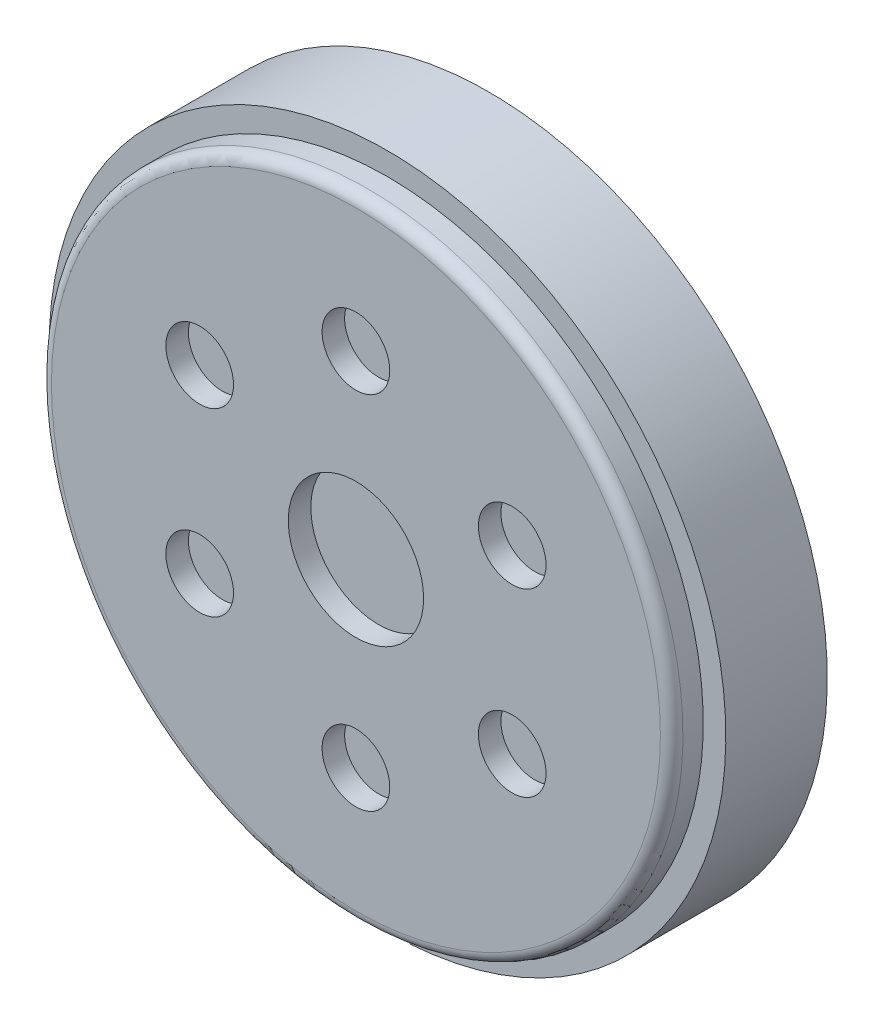
from build123d import *

# Parameters (mm, degrees)
FILLET_1_R          = 0.25
SKETCH_2_R          = 1.5
SKETCH_2_R_2        = 0.75
CUT_EXTRUDE_1_DEPTH = 0.5
CUT_EXTRUDE_2_REACH = 13.036
CUT_EXTRUDE_3_DEPTH = 0.5
CUT_EXTRUDE_4_DEPTH = 0.8
EXTRUDE_1_DEPTH     = 0.2


with BuildPart() as part:
    # Эскиз1 → Повернуть1 (revolve)
    with BuildSketch(Plane(origin=(0, 0, 0), x_dir=(1, 0, 0), z_dir=(0, 1, 0)), mode=Mode.PRIVATE) as revolve_1_sk:
        Polygon((0, 0), (0, -3.75), (-7, -3.75), (-7, -3.05), (-7.5, -3.05), (-7.5, -0.8), (-5.55, -0.8), (-5.55, 0), align=None)
    revolve(revolve_1_sk.sketch.rotate(Axis((0, 0, 0), (0, 0, -1)), 180), axis=Axis((0, 0, 0), (0, 0, -1)))

    # Скругление1
    fillet_1_edges = [part.edges().sort_by_distance(p)[0] for p in [
        (-5.55, 0, 0),
        (-7, 0, 3.75),
    ]]
    fillet(fillet_1_edges, radius=FILLET_1_R)

    # Эскиз2 → Вырез-Вытянуть1 (cut)
    with BuildSketch(Plane.XY.offset(3.75)):
        Circle(SKETCH_2_R)
        with Locations((0, -4)):
            Circle(SKETCH_2_R_2)
        with Locations((-3.464101615, -2)):
            Circle(SKETCH_2_R_2)
        with Locations((-3.464101615, 2)):
            Circle(SKETCH_2_R_2)
        with Locations((0, 4)):
            Circle(SKETCH_2_R_2)
        with Locations((3.464101615, 2)):
            Circle(SKETCH_2_R_2)
        with Locations((3.464101615, -2)):
            Circle(SKETCH_2_R_2)
    extrude(amount=-CUT_EXTRUDE_1_DEPTH, mode=Mode.SUBTRACT)

    # Эскиз3 → Вырез-Вытянуть2 (cut, up to next)
    with BuildSketch(Plane.XY.offset(3.05), mode=Mode.PRIVATE) as cut_extrude_2_sk1:
        with BuildLine():
            Line((0.5, -6.982120022), (0.5, -7.483314774))
            ThreePointArc((0.5, -7.483314774), (0, -7.5), (-0.5, -7.483314774))
            Line((-0.5, -7.483314774), (-0.5, -6.982120022))
            ThreePointArc((-0.5, -6.982120022), (0, -7), (0.5, -6.982120022))
        make_face()
    cut_extrude_2_tool1 = extrude(cut_extrude_2_sk1.sketch, amount=-CUT_EXTRUDE_2_REACH, mode=Mode.PRIVATE) & part.part
    add(cut_extrude_2_tool1.solids().sort_by_distance((0, -7.244238, 3.05))[0], mode=Mode.SUBTRACT)

    # Эскиз4 → Вырез-Вытянуть3 (cut)
    with BuildSketch(Plane(origin=(0, 0, 0.8), x_dir=(-1, 0, 0), z_dir=(0, 0, -1))):
        with BuildLine():
            Line((-4.751554754, -4.435394844), (-4.166748015, -3.889500094))
            ThreePointArc((-4.166748015, -3.889500094), (-5.421022143, -1.761396868), (-5.657160749, 0.697518642))
            Line((-5.657160749, 0.697518642), (-6.451148223, 0.795415996))
            ThreePointArc((-6.451148223, 0.795415996), (-6.181867356, -2.008610463), (-4.751554754, -4.435394844))
        make_face()
        with BuildLine():
            Line((-5.686622337, 3.148384728), (-4.986730357, 2.760891223))
            ThreePointArc((-4.986730357, 2.760891223), (-3.350375938, 4.611396868), (-1.084779161, 5.595824709))
            Line((-1.084779161, 5.595824709), (-1.237028868, 6.381203615))
            ThreePointArc((-1.237028868, 6.381203615), (-3.82060414, 5.258610463), (-5.686622337, 3.148384728))
        make_face()
        with BuildLine():
            Line((1.237028868, 6.381203615), (1.084779161, 5.595824709))
            ThreePointArc((1.084779161, 5.595824709), (3.350375938, 4.611396868), (4.986730357, 2.760891223))
            Line((4.986730357, 2.760891223), (5.686622337, 3.148384728))
            ThreePointArc((5.686622337, 3.148384728), (3.82060414, 5.258610463), (1.237028868, 6.381203615))
        make_face()
        with BuildLine():
            Line((6.451148223, 0.795415996), (5.657160749, 0.697518642))
            ThreePointArc((5.657160749, 0.697518642), (5.421022143, -1.761396868), (4.166748015, -3.889500094))
            Line((4.166748015, -3.889500094), (4.751554754, -4.435394844))
            ThreePointArc((4.751554754, -4.435394844), (6.181867356, -2.008610463), (6.451148223, 0.795415996))
        make_face()
    extrude(amount=-CUT_EXTRUDE_3_DEPTH, mode=Mode.SUBTRACT)

    # Эскиз5 → Вырез-Вытянуть4 (cut)
    with BuildSketch(Plane(origin=(0, 0, 0.8), x_dir=(-1, 0, 0), z_dir=(0, 0, -1))):
        with BuildLine():
            Line((-5, -5.590169944), (-3.7, -4.136725758))
            ThreePointArc((-3.7, -4.136725758), (0, -5.55), (3.7, -4.136725758))
            Line((3.7, -4.136725758), (5, -5.590169944))
            ThreePointArc((5, -5.590169944), (0, -7.5), (-5, -5.590169944))
        make_face()
    extrude(amount=-CUT_EXTRUDE_4_DEPTH, mode=Mode.SUBTRACT)

    # Эскиз6 → Бобышка-Вытянуть1 (add)
    with BuildSketch(Plane(origin=(0, 0, 1.6), x_dir=(-1, 0, 0), z_dir=(0, 0, -1))):
        with BuildLine():
            Line((-1.294304744, -6.904737521), (-1.110062076, -5.921856735))
            ThreePointArc((-1.110062076, -5.921856735), (-2.348915229, -5.548262994), (-3.479427056, -4.918761263))
            Line((-3.479427056, -4.918761263), (-4.056925322, -5.735153174))
            ThreePointArc((-4.056925322, -5.735153174), (-2.738776678, -6.46913652), (-1.294304744, -6.904737521))
        make_face()
        with BuildLine():
            Line((3.479427056, -4.918761263), (4.056925322, -5.735153174))
            ThreePointArc((4.056925322, -5.735153174), (2.738776678, -6.46913652), (1.294304744, -6.904737521))
            Line((1.294304744, -6.904737521), (1.110062076, -5.921856735))
            ThreePointArc((1.110062076, -5.921856735), (2.348915229, -5.548262994), (3.479427056, -4.918761263))
        make_face()
    extrude(amount=EXTRUDE_1_DEPTH)


solid = part.part
